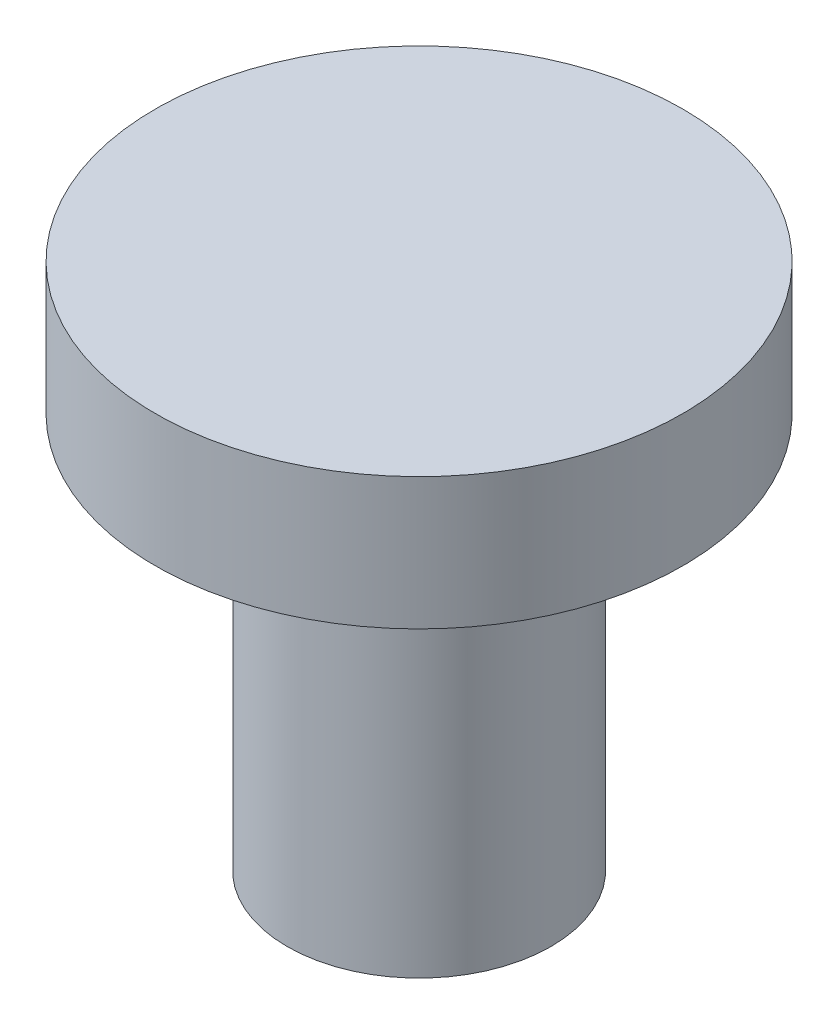
from build123d import *


with BuildPart() as part:
    # Sketch1 → Revolve1 (revolve)
    with BuildSketch(Plane.XY, mode=Mode.PRIVATE) as revolve1_sk:
        Polygon((2, 4), (0, 4), (0, 0), (1, 0), (1, 3), (2, 3), align=None)
    revolve(revolve1_sk.sketch.rotate(Axis((0, 4, 0), (0, -1, 0)), 270), axis=Axis((0, 4, 0), (0, -1, 0)))


solid = part.part
